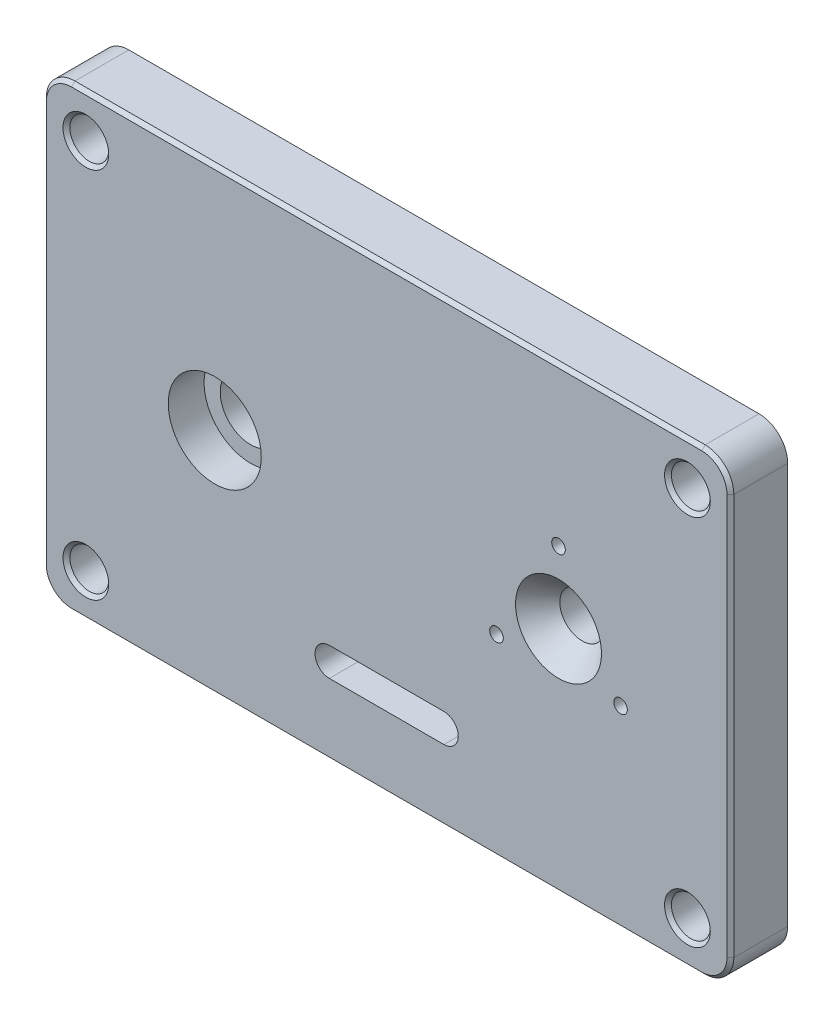
from build123d import *

# Parameters (mm, degrees)
EXTRUDE_1_DEPTH               = 12.7
SKETCH_2_R                    = 4.3053
CUT_EXTRUDE_1_DEPTH           = 184.601770144
CUT_EXTRUDE_2_DEPTH           = 184.601770144
SKETCH_4_R                    = 10.3124
CUT_EXTRUDE_3_DEPTH           = 7.9502
SKETCH_5_R                    = 6.7437
CUT_EXTRUDE_4_DEPTH           = 184.601770144
SKETCH_6_R                    = 9.525
CUT_EXTRUDE_5_DEPTH           = 5.244874679
CUT_EXTRUDE_5_DRAFT           = -41
SKETCH_7_R                    = 4.9657
CUT_EXTRUDE_6_DEPTH           = 184.601770144
SKETCH_8_R                    = 1.50495
CUT_EXTRUDE_7_DEPTH           = 9.525
SKETCH_9_R                    = 1.50495
CUT_EXTRUDE_8_DEPTH           = 0.901260886
CUT_EXTRUDE_8_DRAFT           = -59
CUT_EXTRUDE_8_PROFILE_2_DEPTH = 0.901260886
CUT_EXTRUDE_8_PROFILE_2_DRAFT = -59
CUT_EXTRUDE_8_PROFILE_3_DEPTH = 0.901260886
CUT_EXTRUDE_8_PROFILE_3_DRAFT = -59
CHAMFER_1_SIZE                = 0.762
CHAMFER_2_SIZE                = 0.762


with BuildPart() as part:
    # 草图1 → 凸台-拉伸1 (new body)
    with BuildSketch(Plane.XY):
        with BuildLine():
            Line((6.35, 0), (146.05, 0))
            ThreePointArc((146.05, 0), (150.540128061, 1.859871939), (152.4, 6.35))
            Line((152.4, 6.35), (152.4, 95.25))
            ThreePointArc((152.4, 95.25), (150.540128061, 99.740128061), (146.05, 101.6))
            Line((146.05, 101.6), (6.35, 101.6))
            ThreePointArc((6.35, 101.6), (1.859871939, 99.740128061), (0, 95.25))
            Line((0, 95.25), (0, 6.35))
            ThreePointArc((0, 6.35), (1.859871939, 1.859871939), (6.35, 0))
        make_face()
    extrude(amount=EXTRUDE_1_DEPTH)

    # 草图2 → 切除-拉伸1 (cut, through all)
    with BuildSketch(Plane.XY.offset(12.7)):
        with Locations((9.525, 9.525)):
            Circle(SKETCH_2_R)
        with Locations((142.875, 9.525)):
            Circle(SKETCH_2_R)
        with Locations((9.525, 92.075)):
            Circle(SKETCH_2_R)
        with Locations((142.875, 92.075)):
            Circle(SKETCH_2_R)
    extrude(amount=-CUT_EXTRUDE_1_DEPTH, mode=Mode.SUBTRACT)

    # 草图3 → 切除-拉伸2 (cut, through all)
    with BuildSketch(Plane.XY.offset(12.7)):
        with BuildLine():
            Line((63.5, 15.875), (88.9, 15.875))
            ThreePointArc((88.9, 15.875), (92.075, 19.05), (88.9, 22.225))
            Line((88.9, 22.225), (63.5, 22.225))
            ThreePointArc((63.5, 22.225), (60.325, 19.05), (63.5, 15.875))
        make_face()
    extrude(amount=-CUT_EXTRUDE_2_DEPTH, mode=Mode.SUBTRACT)

    # 草图4 → 切除-拉伸3 (cut)
    with BuildSketch(Plane.XY.offset(12.7)):
        with Locations((38.1, 50.8)):
            Circle(SKETCH_4_R)
    extrude(amount=-CUT_EXTRUDE_3_DEPTH, mode=Mode.SUBTRACT)

    # 草图5 → 切除-拉伸4 (cut, through all)
    with BuildSketch(Plane.XY.offset(12.7)):
        with Locations((38.1, 50.8)):
            Circle(SKETCH_5_R)
    extrude(amount=-CUT_EXTRUDE_4_DEPTH, mode=Mode.SUBTRACT)


with BuildPart() as cut_extrude_5_tool:
    # 草图6 → 切除-拉伸5 (with draft: the straight prism first)
    with BuildSketch(Plane.XY.offset(12.7)):
        with Locations((114.3, 50.8)):
            Circle(SKETCH_6_R)
    extrude(amount=-CUT_EXTRUDE_5_DEPTH)
    # 切除-拉伸5: the draft: its side faces are tilted about the plane it starts from
    cut_extrude_5_sides = [cut_extrude_5_tool.faces().sort_by_distance(p)[0] for p in [
        (104.775, 50.8, 10.07756266),
    ]]
    draft(cut_extrude_5_sides, Plane.XY.offset(12.7), CUT_EXTRUDE_5_DRAFT)


with BuildPart() as part_1:
    add(part.part)

    # 切除-拉伸5: cut by cut_extrude_5_tool
    add(cut_extrude_5_tool.part, mode=Mode.SUBTRACT)

    # 草图7 → 切除-拉伸6 (cut, through all)
    with BuildSketch(Plane.XY.offset(12.7)):
        with Locations((114.3, 50.8)):
            Circle(SKETCH_7_R)
    extrude(amount=-CUT_EXTRUDE_6_DEPTH, mode=Mode.SUBTRACT)

    # 草图8 → 切除-拉伸7 (cut)
    with BuildSketch(Plane.XY.offset(12.7)):
        with Locations((114.3, 66.675)):
            Circle(SKETCH_8_R)
        with Locations((100.551847, 42.8625)):
            Circle(SKETCH_8_R)
        with Locations((128.048153, 42.8625)):
            Circle(SKETCH_8_R)
    extrude(amount=-CUT_EXTRUDE_7_DEPTH, mode=Mode.SUBTRACT)


with BuildPart() as cut_extrude_8_tool:
    # 草图9 → 切除-拉伸8 (with draft: the straight prism first)
    with BuildSketch(Plane.XY.offset(3.175)):
        with Locations((114.3, 66.675)):
            Circle(SKETCH_9_R)
    extrude(amount=-CUT_EXTRUDE_8_DEPTH)
    # 切除-拉伸8: the draft: its side faces are tilted about the plane it starts from
    cut_extrude_8_sides = [cut_extrude_8_tool.faces().sort_by_distance(p)[0] for p in [
        (112.79505, 66.675, 2.724369557),
    ]]
    draft(cut_extrude_8_sides, Plane.XY.offset(3.175), CUT_EXTRUDE_8_DRAFT)


with BuildPart() as part_2:
    add(part_1.part)

    # 切除-拉伸8: cut by cut_extrude_8_tool
    add(cut_extrude_8_tool.part, mode=Mode.SUBTRACT)


with BuildPart() as cut_extrude_8_profile_2_tool:
    # 草图9 → 切除-拉伸8 profile 2 (with draft: the straight prism first)
    with BuildSketch(Plane.XY.offset(3.175)):
        with Locations((100.551847, 42.8625)):
            Circle(SKETCH_9_R)
    extrude(amount=-CUT_EXTRUDE_8_PROFILE_2_DEPTH)
    # 切除-拉伸8 profile 2: the draft: its side faces are tilted about the plane it starts from
    cut_extrude_8_profile_2_sides = [cut_extrude_8_profile_2_tool.faces().sort_by_distance(p)[0] for p in [
        (99.046897, 42.8625, 2.724369557),
    ]]
    draft(cut_extrude_8_profile_2_sides, Plane.XY.offset(3.175), CUT_EXTRUDE_8_PROFILE_2_DRAFT)


with BuildPart() as part_3:
    add(part_2.part)

    # 切除-拉伸8 profile 2: cut by cut_extrude_8_profile_2_tool
    add(cut_extrude_8_profile_2_tool.part, mode=Mode.SUBTRACT)


with BuildPart() as cut_extrude_8_profile_3_tool:
    # 草图9 → 切除-拉伸8 profile 3 (with draft: the straight prism first)
    with BuildSketch(Plane.XY.offset(3.175)):
        with Locations((128.048153, 42.8625)):
            Circle(SKETCH_9_R)
    extrude(amount=-CUT_EXTRUDE_8_PROFILE_3_DEPTH)
    # 切除-拉伸8 profile 3: the draft: its side faces are tilted about the plane it starts from
    cut_extrude_8_profile_3_sides = [cut_extrude_8_profile_3_tool.faces().sort_by_distance(p)[0] for p in [
        (126.543203, 42.8625, 2.724369557),
    ]]
    draft(cut_extrude_8_profile_3_sides, Plane.XY.offset(3.175), CUT_EXTRUDE_8_PROFILE_3_DRAFT)


with BuildPart() as part_4:
    add(part_3.part)

    # 切除-拉伸8 profile 3: cut by cut_extrude_8_profile_3_tool
    add(cut_extrude_8_profile_3_tool.part, mode=Mode.SUBTRACT)

    # 倒角1
    chamfer_1_edges = [part_4.edges().sort_by_distance(p)[0] for p in [
        (150.540128061, 1.859871939, 12.7),
        (152.4, 50.8, 12.7),
        (150.540128061, 99.740128061, 12.7),
        (76.2, 101.6, 12.7),
        (1.859871939, 99.740128061, 12.7),
        (0, 50.8, 12.7),
        (1.859871939, 1.859871939, 12.7),
        (76.2, 0, 12.7),
    ]]
    chamfer(chamfer_1_edges, length=CHAMFER_1_SIZE)

    # 倒角2
    chamfer_2_edges = [part_4.edges().sort_by_distance(p)[0] for p in [
        (138.5697, 9.525, 12.7),
        (5.2197, 92.075, 12.7),
        (138.5697, 92.075, 12.7),
        (5.2197, 9.525, 12.7),
    ]]
    chamfer(chamfer_2_edges, length=CHAMFER_2_SIZE)


solid = part_4.part
